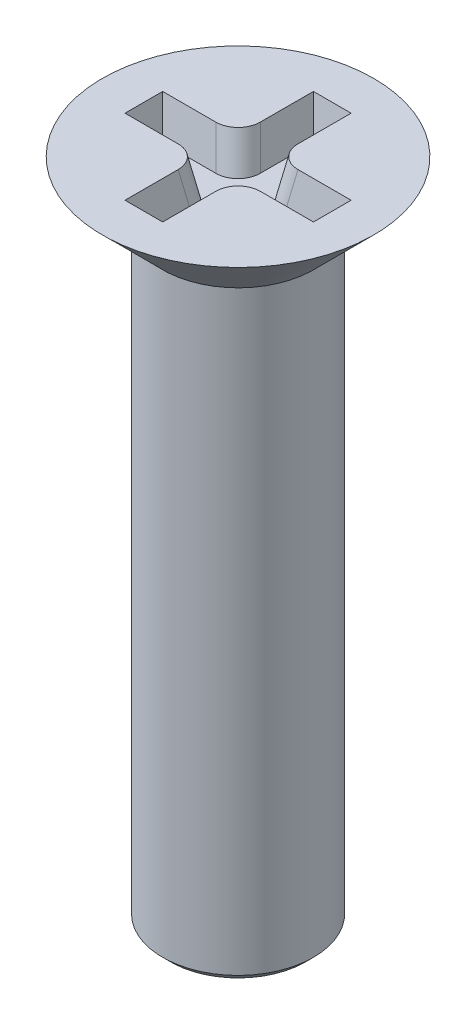
from build123d import *

# Parameters (mm, degrees)
SKETCH_2_R                    = 1
EXTRUDE_1_DEPTH               = 8
CHAMFER_1_SIZE                = 0.1
SKETCH_3_W                    = 2.5
SKETCH_3_H                    = 0.5
CUT_EXTRUDE_1_DEPTH           = 0.5
CUT_EXTRUDE_1_DRAFT           = -10
SKETCH_3_W_2                  = 0.5
SKETCH_3_H_2                  = 2.5
CUT_EXTRUDE_1_PROFILE_2_DEPTH = 0.5
CUT_EXTRUDE_1_PROFILE_2_DRAFT = -10
FILLET_1_R                    = 0.3


with BuildPart() as part:
    # 草图1 → 旋转1 (revolve)
    with BuildSketch(Plane.XY, mode=Mode.PRIVATE) as revolve_1_sk:
        Polygon((0, 0), (1.8, 0), (1, -0.8), (0, -0.8), align=None)
    revolve(revolve_1_sk.sketch.rotate(Axis((0, -0.8, 0), (0, 1, 0)), 90), axis=Axis((0, -0.8, 0), (0, 1, 0)))

    # 草图2 → 凸台-拉伸1 (add)
    with BuildSketch(Plane.XZ.offset(0.8)):
        with Locations(Location((0, 0, 0), (0, 0, 270))):
            Circle(SKETCH_2_R)
    extrude(amount=EXTRUDE_1_DEPTH)

    # 倒角1
    chamfer_1_edges = [part.edges().sort_by_distance(p)[0] for p in [
        (0, -8.8, 1),
    ]]
    chamfer(chamfer_1_edges, length=CHAMFER_1_SIZE)


with BuildPart() as cut_extrude_1_tool:
    # 草图3 → 切除-拉伸1 (with draft: the straight prism first)
    with BuildSketch(Plane(origin=(0, 0, 0), x_dir=(1, 0, 0), z_dir=(0, 1, 0))):
        Rectangle(SKETCH_3_W, SKETCH_3_H)
    extrude(amount=-CUT_EXTRUDE_1_DEPTH)
    # 切除-拉伸1: the draft: its side faces are tilted about the plane it starts from
    cut_extrude_1_sides = [cut_extrude_1_tool.faces().sort_by_distance(p)[0] for p in [
        (0, -0.25, 0.25),
        (1.25, -0.25, 0),
        (0, -0.25, -0.25),
        (-1.25, -0.25, 0),
    ]]
    draft(cut_extrude_1_sides, Plane(origin=(0, 0, 0), x_dir=(1, 0, 0), z_dir=(0, 1, 0)), CUT_EXTRUDE_1_DRAFT)


with BuildPart() as part_1:
    add(part.part)

    # 切除-拉伸1: cut by cut_extrude_1_tool
    add(cut_extrude_1_tool.part, mode=Mode.SUBTRACT)


with BuildPart() as cut_extrude_1_profile_2_tool:
    # 草图3 → 切除-拉伸1 profile 2 (with draft: the straight prism first)
    with BuildSketch(Plane(origin=(0, 0, 0), x_dir=(1, 0, 0), z_dir=(0, 1, 0))):
        Rectangle(SKETCH_3_W_2, SKETCH_3_H_2)
    extrude(amount=-CUT_EXTRUDE_1_PROFILE_2_DEPTH)
    # 切除-拉伸1 profile 2: the draft: its side faces are tilted about the plane it starts from
    cut_extrude_1_profile_2_sides = [cut_extrude_1_profile_2_tool.faces().sort_by_distance(p)[0] for p in [
        (-0.25, -0.25, 0),
        (0, -0.25, 1.25),
        (0.25, -0.25, 0),
        (0, -0.25, -1.25),
    ]]
    draft(cut_extrude_1_profile_2_sides, Plane(origin=(0, 0, 0), x_dir=(1, 0, 0), z_dir=(0, 1, 0)), CUT_EXTRUDE_1_PROFILE_2_DRAFT)


with BuildPart() as part_2:
    add(part_1.part)

    # 切除-拉伸1 profile 2: cut by cut_extrude_1_profile_2_tool
    add(cut_extrude_1_profile_2_tool.part, mode=Mode.SUBTRACT)

    # 圆角1
    fillet_1_edges = [part_2.edges().sort_by_distance(p)[0] for p in [
        (0.205918255, -0.25, -0.205918255),
        (0.205918255, -0.25, 0.205918255),
        (-0.205918255, -0.25, 0.205918255),
        (-0.205918255, -0.25, -0.205918255),
    ]]
    fillet(fillet_1_edges, radius=FILLET_1_R)


solid = part_2.part
